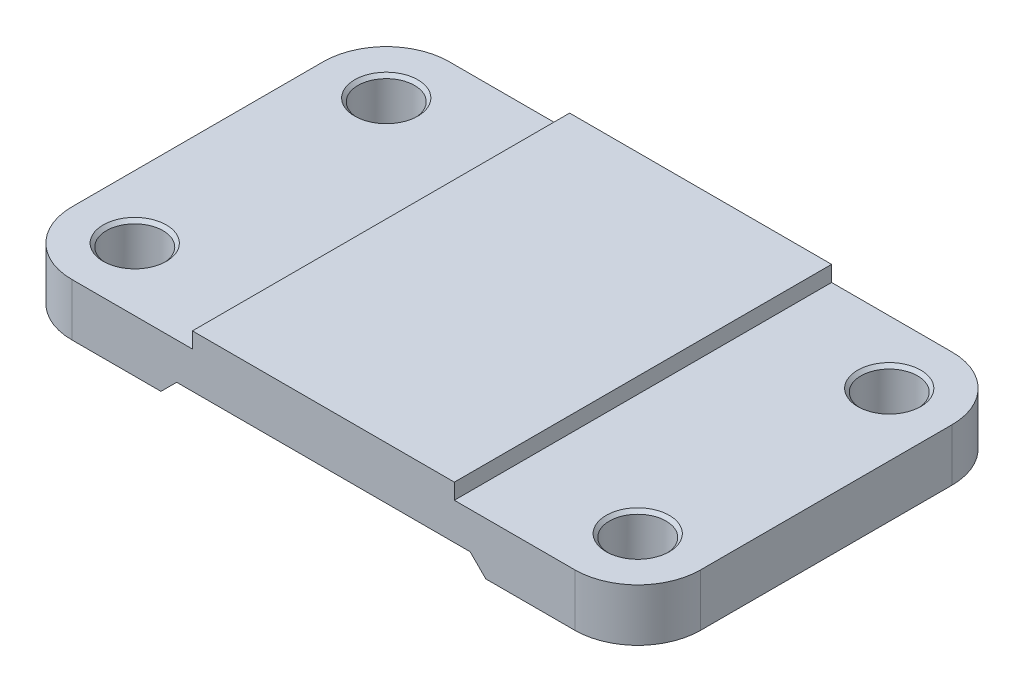
from build123d import *

# Parameters (mm, degrees)
BOSS_EXTRUDE1_DEPTH               = 36
FILLET1_R                         = 12
M12X1_25_TAPPED_HOLE1_D           = 10.8
M12X1_25_TAPPED_HOLE1_DEPTH       = 24.505352657
M12X1_25_TAPPED_HOLE1_CSINK_D     = 12.05
M12X1_25_TAPPED_HOLE1_CSINK_ANGLE = 90
M12X1_25_TAPPED_HOLE1_TIP         = 3.244647343


with BuildPart() as part:
    # Sketch1 → Boss-Extrude1 (new, symmetric)
    with BuildSketch(Plane.XY):
        Polygon((-28, 3), (-31, 0), (-60, 0), (-60, 10), (-25, 10), (-25, 13), (25, 13), (25, 10), (60, 10), (60, 0), (31, 0), (28, 3), align=None)
    extrude(amount=BOSS_EXTRUDE1_DEPTH, both=True)

    # Fillet1
    fillet1_edges = [part.edges().sort_by_distance(p)[0] for p in [
        (-60, 5, -36),
        (60, 5, -36),
        (60, 5, 36),
        (-60, 5, 36),
    ]]
    fillet(fillet1_edges, radius=FILLET1_R)

    # M12x1.25 Tapped Hole1
    with Locations(Plane(origin=(0, 10, 0), x_dir=(1, 0, 0), z_dir=(0, 1, 0))):
        with Locations((-48, 24), (-48, -24), (48, -24), (48, 24)):
            CounterSinkHole(M12X1_25_TAPPED_HOLE1_D / 2, M12X1_25_TAPPED_HOLE1_CSINK_D / 2, depth=M12X1_25_TAPPED_HOLE1_DEPTH, counter_sink_angle=M12X1_25_TAPPED_HOLE1_CSINK_ANGLE)
            with Locations((0, 0, -(M12X1_25_TAPPED_HOLE1_DEPTH + M12X1_25_TAPPED_HOLE1_TIP / 2))):  # 118° drill point
                Cone(0, M12X1_25_TAPPED_HOLE1_D / 2, M12X1_25_TAPPED_HOLE1_TIP, mode=Mode.SUBTRACT)


solid = part.part
